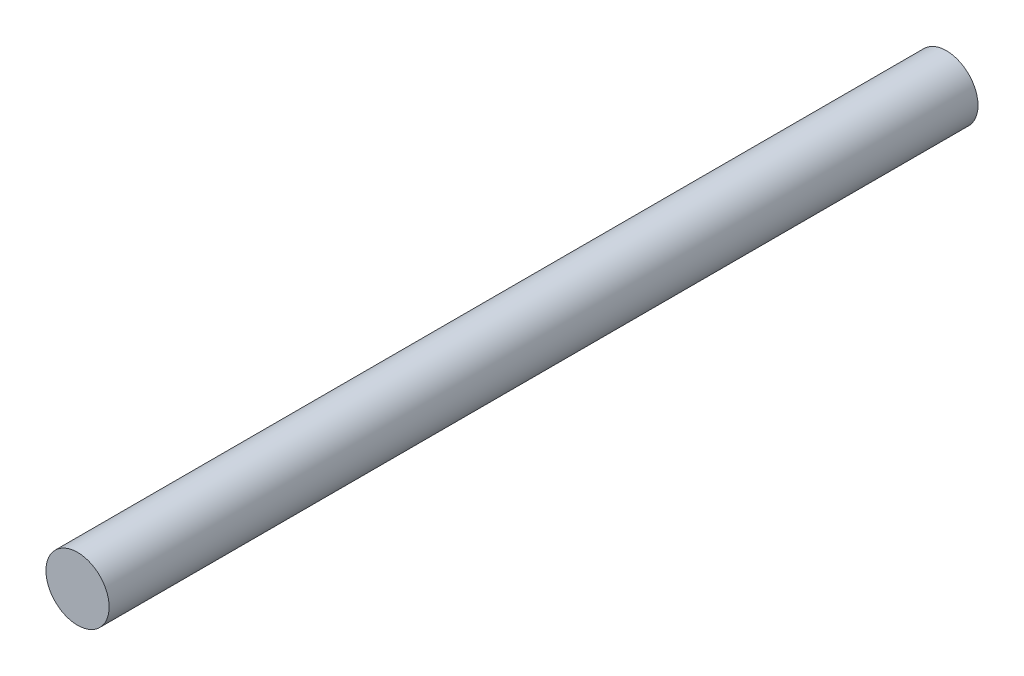
from build123d import *

# Parameters (mm, degrees)
ESQUISSE1_R        = 10
BOSS_EXTRU_1_DEPTH = 137.5


with BuildPart() as part:
    # Esquisse1 → Boss.-Extru.1 (new, symmetric)
    with BuildSketch(Plane.XY):
        Circle(ESQUISSE1_R)
    extrude(amount=BOSS_EXTRU_1_DEPTH, both=True)


solid = part.part
